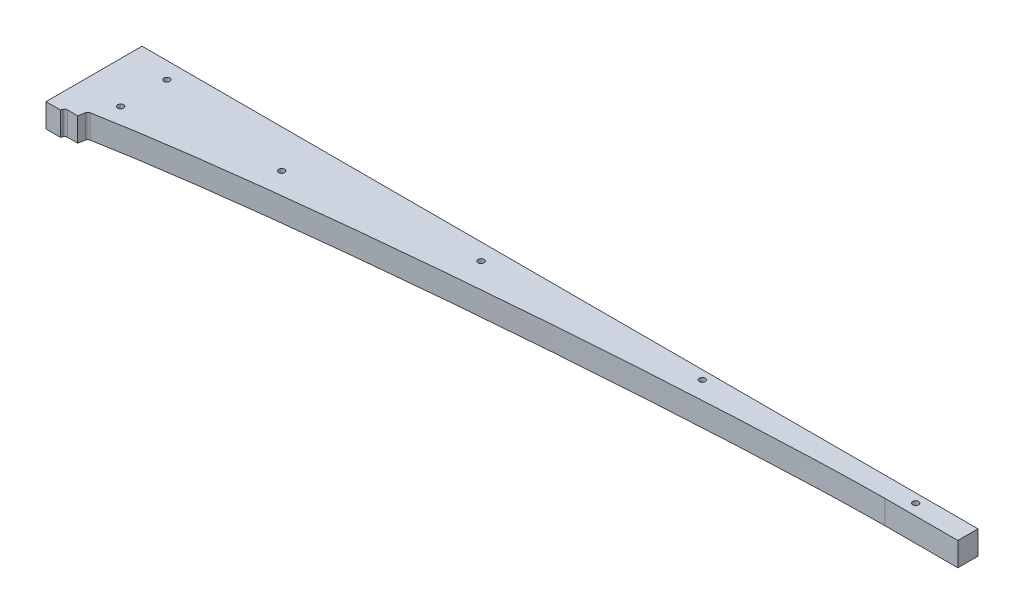
from build123d import *

# Parameters (mm, degrees)
SKETCH1_R           = 3.175
BOSS_EXTRUDE1_DEPTH = 25.4
FILLET1_R           = 3.175


with BuildPart() as part:
    # Sketch1 (on Top Plane) → Boss-Extrude1 (new body)
    with BuildSketch(Plane(origin=(0, 0, 0), x_dir=(1, 0, 0), z_dir=(0, 1, 0))):
        with BuildLine():
            Line((21.236708827, 102.87), (21.236708827, 0))
            Line((21.236708827, 0), (33.93670901, 0))
            Line((33.93670901, 0), (36.685985199, 0))
            Line((36.685985199, 0), (38.264138871, 3.81))
            Line((38.264138871, 3.81), (51.398278194, 3.81))
            Line((51.398278194, 3.81), (52.996677053, 12.874970388))
            add(Edge.make_bspline(
                [(52.996677053, 12.874970388), (53.503573659, 12.970456896), (54.499660255, 13.157404611), (56.101158607, 13.455975027), (57.663492356, 13.744988885), (59.683937793, 14.115659666), (62.15348224, 14.563331695), (65.170518963, 15.103156387), (68.231004621, 15.644086126), (72.288386319, 16.351836474), (79.324536107, 17.555493521), (89.492362091, 19.238273344), (105.683337087, 21.809296224), (126.007402708, 24.866297862), (158.54183076, 29.467314799), (199.286173571, 34.777983678), (264.569984849, 42.553821851), (346.311852481, 51.162108318), (444.543686218, 60.086524235), (542.885062348, 67.730751053), (624.910991839, 73.034056624), (690.569900499, 76.552162095), (731.621303417, 78.407861838), (764.4690412, 79.64241837), (789.108361632, 80.421082634), (809.63843083, 80.924660048), (826.066348864, 81.194620604), (834.261568503, 81.28), (838.361715067, 81.28)],
                knots=[0.063996746, 0.063996746, 0.063996746, 0.063996746, 0.065824877, 0.067653009, 0.06948114, 0.071309272, 0.074965534, 0.078621797, 0.08227806, 0.085934322, 0.093246848, 0.107871899, 0.122496949, 0.151747051, 0.180997153, 0.239497356, 0.297997559, 0.414997966, 0.531998373, 0.648998779, 0.765999186, 0.824499389, 0.882999593, 0.912249694, 0.941499796, 0.970749898, 0.985374949, 0.999999999, 0.999999999, 0.999999999, 0.999999999], degree=3))
            Line((838.361715067, 81.28), (889.161715067, 81.28))
            Line((889.161715067, 81.28), (916.641442525, 81.28))
            Line((916.641442525, 81.28), (916.641442525, 83.82))
            Line((916.641442525, 83.82), (916.641442525, 102.87))
            Line((916.641442525, 102.87), (21.236708827, 102.87))
        make_face()
        with Locations(Location((859.436708827, 93.345, 0), (0, 0, 90))):
            Circle(SKETCH1_R, mode=Mode.SUBTRACT)
        with Locations(Location((65.686708827, 85.09, 0), (0, 0, 90))):
            Circle(SKETCH1_R, mode=Mode.SUBTRACT)
        with Locations(Location((211.736708827, 61.976, 0), (0, 0, 90))):
            Circle(SKETCH1_R, mode=Mode.SUBTRACT)
        with Locations(Location((630.836708827, 93.345, 0), (0, 0, 90))):
            Circle(SKETCH1_R, mode=Mode.SUBTRACT)
        with Locations(Location((402.236708827, 85.09, 0), (0, 0, 90))):
            Circle(SKETCH1_R, mode=Mode.SUBTRACT)
        with Locations(Location((65.686708827, 35.56, 0), (0, 0, 90))):
            Circle(SKETCH1_R, mode=Mode.SUBTRACT)
    extrude(amount=BOSS_EXTRUDE1_DEPTH)

    # Fillet1
    fillet1_edges = [part.edges().sort_by_distance(p)[0] for p in [
        (52.996677053, 12.7, -12.874970388),
        (38.264138871, 12.7, -3.81),
    ]]
    fillet(fillet1_edges, radius=FILLET1_R)


solid = part.part
